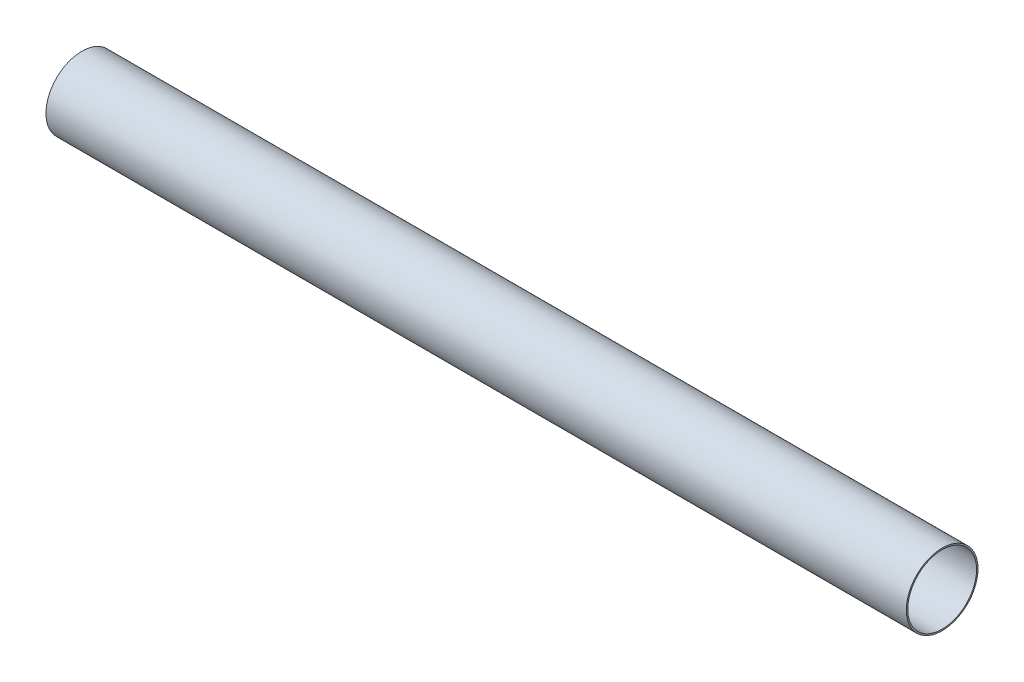
from build123d import *

# Parameters (mm, degrees)
SKETCH1_R           = 3
SKETCH1_R_2         = 2.88
BOSS_EXTRUDE1_DEPTH = 72


with BuildPart() as part:
    # Sketch1 → Boss-Extrude1 (new body)
    with BuildSketch(Plane(origin=(0, 0, 0), x_dir=(0, 0, -1), z_dir=(1, 0, 0))):
        Circle(SKETCH1_R)
        Circle(SKETCH1_R_2, mode=Mode.SUBTRACT)
    extrude(amount=BOSS_EXTRUDE1_DEPTH)


solid = part.part
